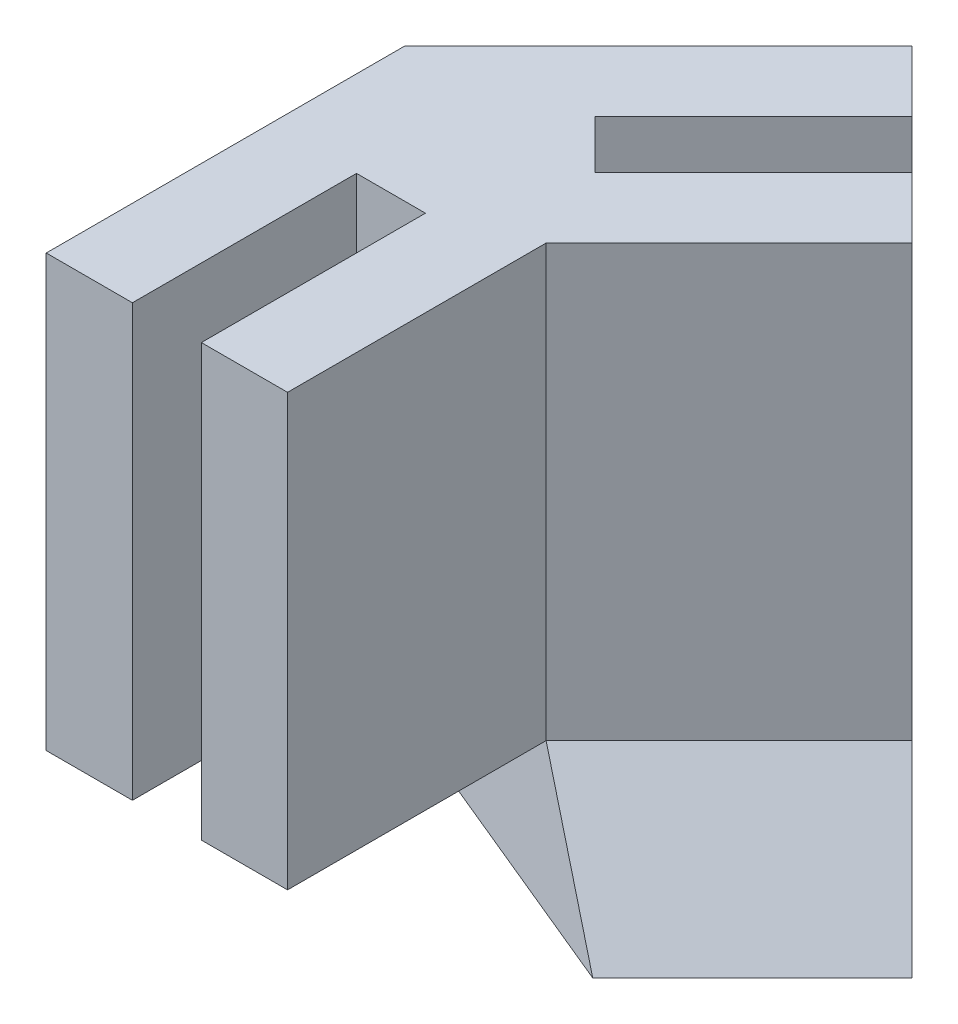
from build123d import *

# Parameters (mm, degrees)
BOSS_EXTRUDE1_DEPTH = 25
BOSS_EXTRUDE3_REACH = 40.303


with BuildPart() as part:
    # Sketch2 → Boss-Extrude1 (new body)
    with BuildSketch(Plane(origin=(0, 0, 0), x_dir=(1, 0, 0), z_dir=(0, 1, 0))):
        Polygon((0, 0), (0, -15), (-5, -15), (-5, -2), (-9, -2), (-9, -15), (-14, -15), (-14, 5.798989873), align=None)
    boss_extrude1 = extrude(amount=BOSS_EXTRUDE1_DEPTH)

    # Mirror1: Boss-Extrude1 across plane
    add(boss_extrude1.mirror(Plane(origin=(0, 25, 0), x_dir=(0.9238795325112891, 0, 0.382683432365084), z_dir=(-0.382683432365084, 0, 0.9238795325112892))))

    # Boss-Extrude3: up to this plane
    boss_extrude3_end = Plane(origin=(10.606601718, 25, -10.606601718), z_dir=(0.7071067811865388, 0, -0.7071067811865563))
    # Sketch4 → Boss-Extrude3 (add, up to the surface)
    with BuildSketch(Plane(origin=(0, 0, 0), x_dir=(-0.9238795325112892, 0, -0.38268343236508406), z_dir=(0.3826834323650841, 0, -0.9238795325112893)), mode=Mode.PRIVATE) as boss_extrude3_sk1:
        Polygon((0, 0), (-5, -8.660254038), (10.153490804, -8.660254038), (15.153490804, 0), align=None)
    boss_extrude3_tool1 = split(extrude(boss_extrude3_sk1.sketch, amount=BOSS_EXTRUDE3_REACH, dir=(0.707106781187, 0, -0.707106781187), mode=Mode.PRIVATE), bisect_by=boss_extrude3_end, keep=Keep.BOTH, mode=Mode.PRIVATE)
    add(boss_extrude3_tool1.solids().sort_by_distance((-4.690301, -4.330127, -1.942786))[0])


solid = part.part
